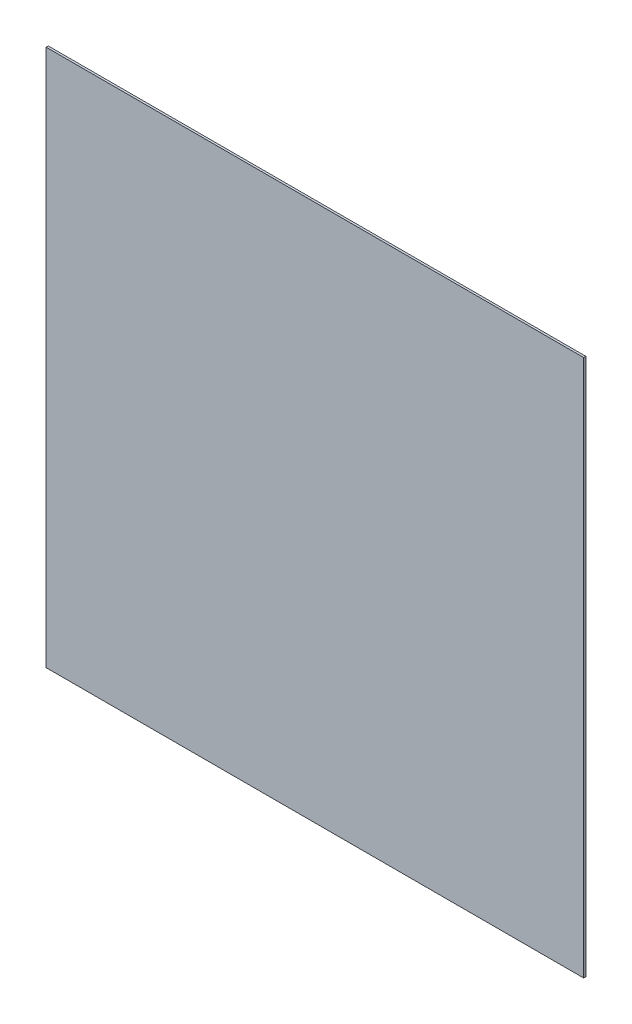
from build123d import *

# Parameters (mm, degrees)
SKIZZE1_W                       = 1000
SKIZZE1_H                       = 1000
AUFSATZ_LINEAR_AUSTRAGEN1_DEPTH = 4


with BuildPart() as part:
    # Skizze1 → Aufsatz-Linear austragen1 (new body)
    with BuildSketch(Plane.XY):
        with Locations((0, -496)):
            Rectangle(SKIZZE1_W, SKIZZE1_H)
    extrude(amount=AUFSATZ_LINEAR_AUSTRAGEN1_DEPTH)


solid = part.part
